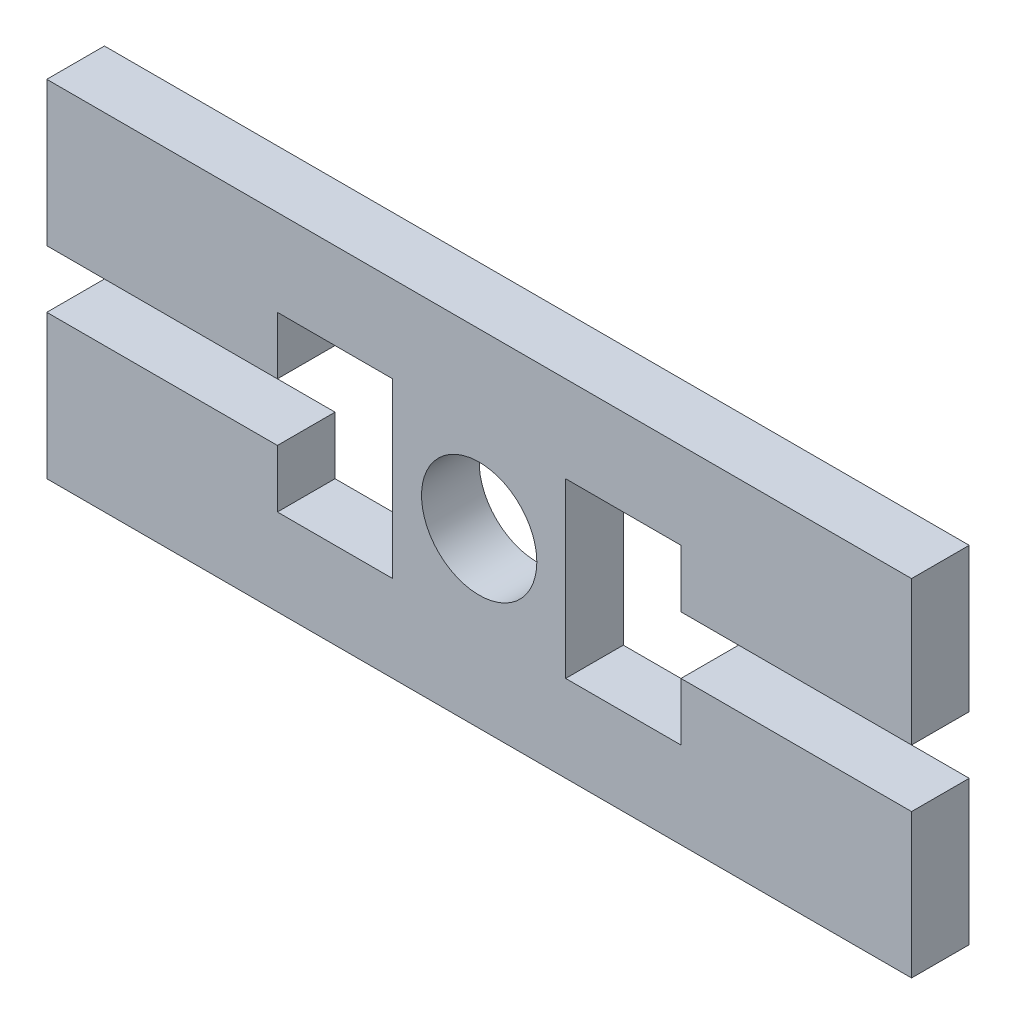
from build123d import *

# Parameters (mm, degrees)
SKETCH1_R           = 12.7
BOSS_EXTRUDE1_DEPTH = 12.7


with BuildPart() as part:
    # Sketch1 → Boss-Extrude1 (new body)
    with BuildSketch(Plane.XY):
        Polygon((-95.25, 38.1), (95.25, 38.1), (95.25, 6.35), (44.45, 6.35), (44.45, 19.05), (19.05, 19.05), (19.05, -19.05), (44.45, -19.05), (44.45, -6.35), (95.25, -6.35), (95.25, -38.1), (-95.25, -38.1), (-95.25, -6.35), (-44.45, -6.35), (-44.45, -19.05), (-19.05, -19.05), (-19.05, 19.05), (-44.45, 19.05), (-44.45, 6.35), (-95.25, 6.35), align=None)
        Circle(SKETCH1_R, mode=Mode.SUBTRACT)
    extrude(amount=BOSS_EXTRUDE1_DEPTH)


solid = part.part
